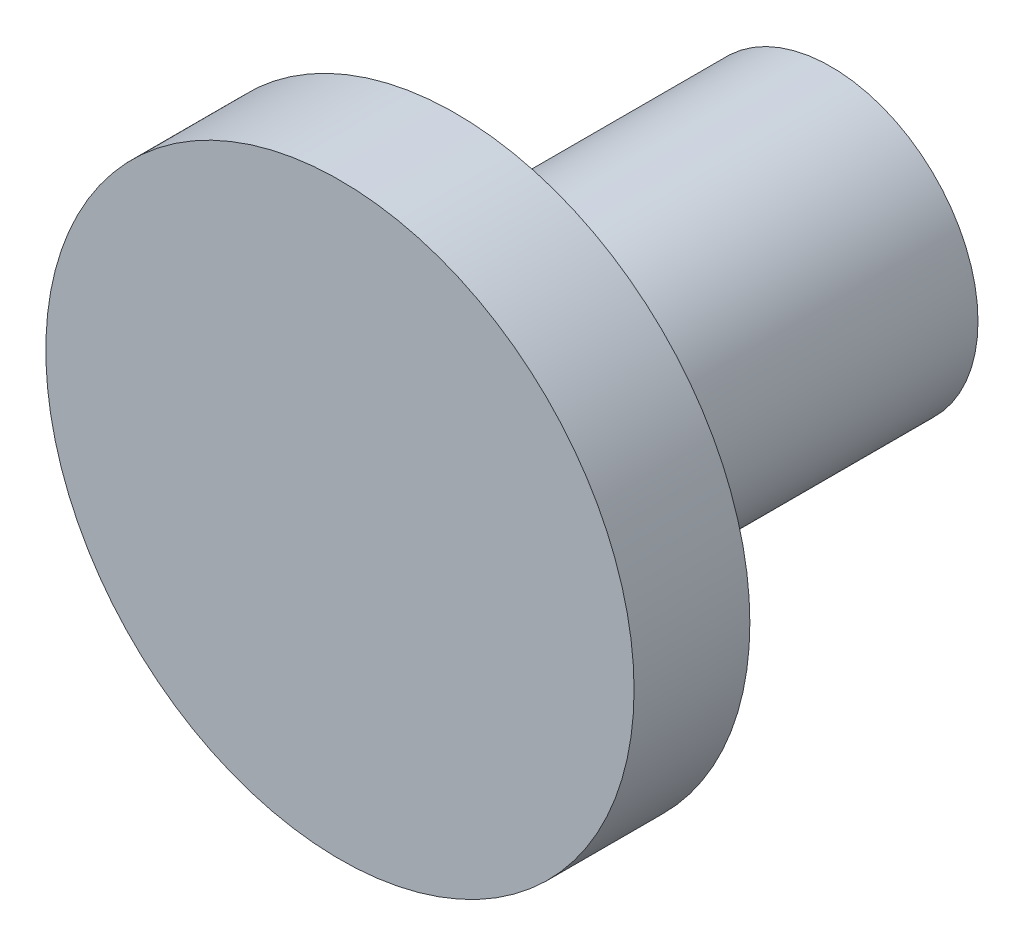
from build123d import *

# Parameters (mm, degrees)
CROQUIS1_R              = 12.7
SALIENTE_EXTRUIR1_DEPTH = 5
CROQUIS2_R              = 6.35
SALIENTE_EXTRUIR2_DEPTH = 16.2


with BuildPart() as part:
    # Croquis1 → Saliente-Extruir1 (new body)
    with BuildSketch(Plane.XY):
        Circle(CROQUIS1_R)
    extrude(amount=SALIENTE_EXTRUIR1_DEPTH)

    # Croquis2 → Saliente-Extruir2 (add)
    with BuildSketch(Plane(origin=(0, 0, 0), x_dir=(-1, 0, 0), z_dir=(0, 0, -1))):
        with Locations(Location((0, 0, 0), (0, 0, 180))):
            Circle(CROQUIS2_R)
    extrude(amount=SALIENTE_EXTRUIR2_DEPTH)


solid = part.part
